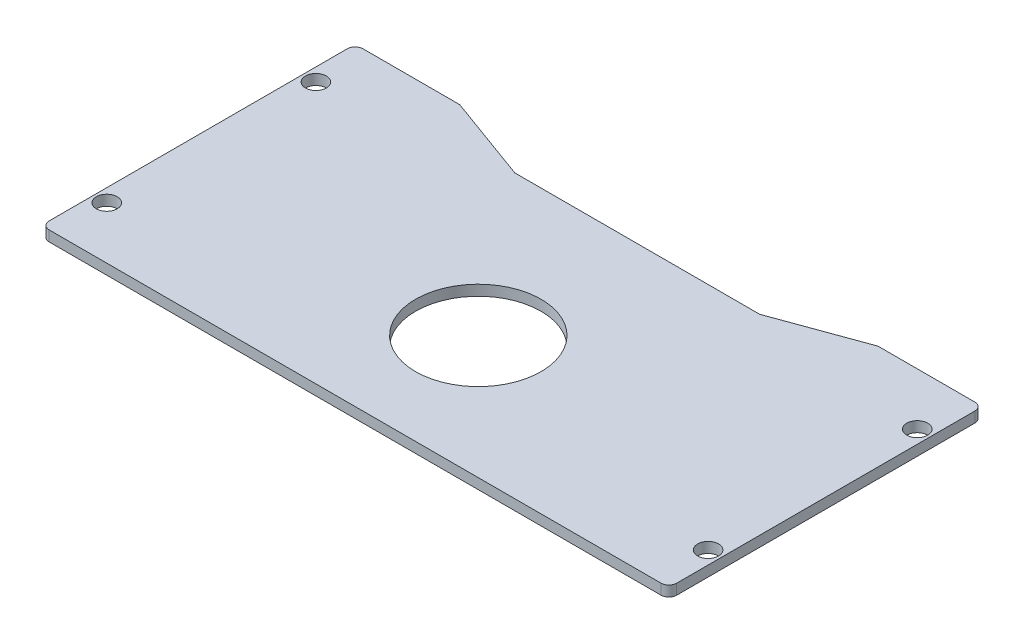
from build123d import *

# Parameters (mm, degrees)
SKETCH_1_W          = 120
SKETCH_1_H          = 60
EXTRUDE_1_DEPTH     = 2
SKETCH_2_R          = 2
CUT_EXTRUDE_1_DEPTH = 2
SKETCH_3_R          = 12
CUT_EXTRUDE_2_DEPTH = 2
FILLET_1_R          = 1.5


with BuildPart() as part:
    # 草图1 → 凸台-拉伸1 (new body)
    with BuildSketch(Plane(origin=(0, 0, 0), x_dir=(1, 0, 0), z_dir=(0, 1, 0))):
        with Locations((60, 30)):
            Rectangle(SKETCH_1_W, SKETCH_1_H)
    extrude(amount=EXTRUDE_1_DEPTH)

    # 草图2 → 切除-拉伸1 (cut)
    with BuildSketch(Plane(origin=(0, 2, 0), x_dir=(1, 0, 0), z_dir=(0, 1, 0))):
        with Locations(Location((117.5, 50, 0), (0, 0, 270))):
            Circle(SKETCH_2_R)
        with Locations(Location((117.5, 10, 0), (0, 0, 90))):
            Circle(SKETCH_2_R)
        with Locations(Location((2.5, 50, 0), (0, 0, 90))):
            Circle(SKETCH_2_R)
        with Locations(Location((2.5, 10, 0), (0, 0, 270))):
            Circle(SKETCH_2_R)
    extrude(amount=-CUT_EXTRUDE_1_DEPTH, mode=Mode.SUBTRACT)

    # 草图3 → 切除-拉伸2 (cut)
    with BuildSketch(Plane(origin=(0, 2, 0), x_dir=(1, 0, 0), z_dir=(0, 1, 0))):
        with Locations(Location((60, 23.556349186, 0), (0, 0, 270))):
            Circle(SKETCH_3_R)
        Polygon((20, 60), (36.582438817, 53.964485859), (83.417561183, 53.964485859), (100, 60), align=None)
    extrude(amount=-CUT_EXTRUDE_2_DEPTH, mode=Mode.SUBTRACT)

    # 圆角1
    fillet_1_edges = [part.edges().sort_by_distance(p)[0] for p in [
        (0, 1, -60),
        (120, 1, -60),
        (120, 1, 0),
        (0, 1, 0),
    ]]
    fillet(fillet_1_edges, radius=FILLET_1_R)


solid = part.part
